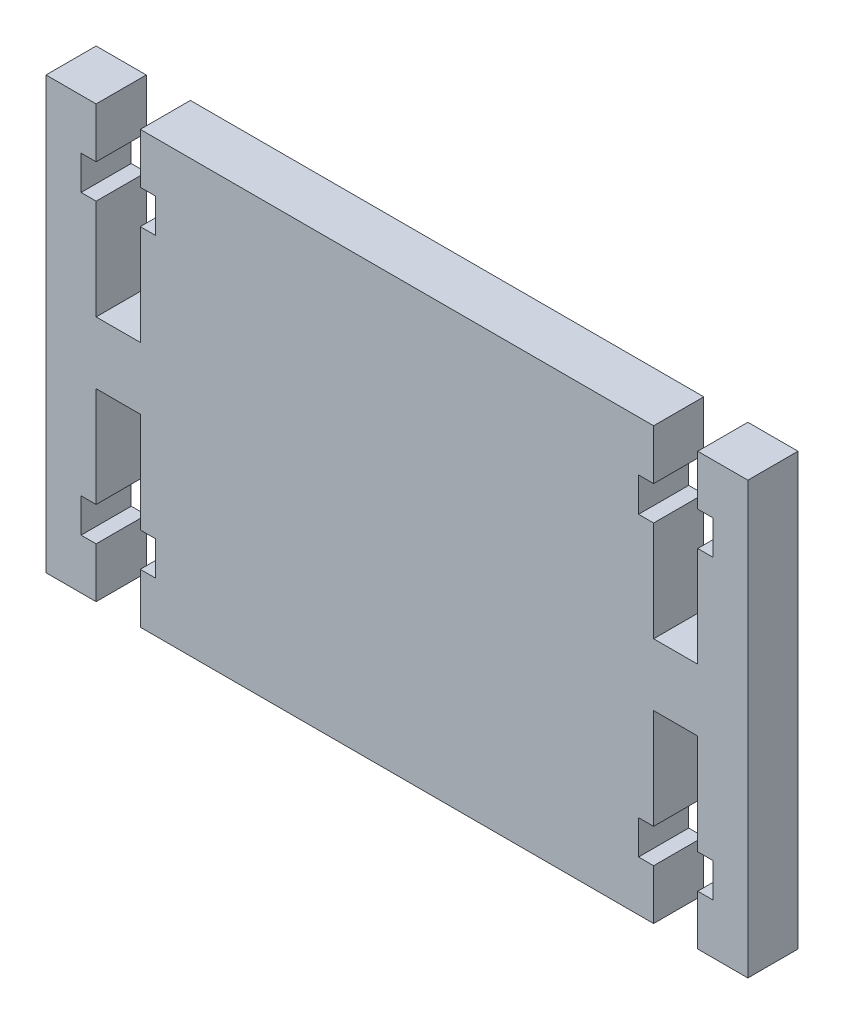
from build123d import *

# Parameters (mm, degrees)
SKETCH1_W           = 70
SKETCH1_H           = 43
BOSS_EXTRUDE1_DEPTH = 5
CUT_EXTRUDE1_DEPTH  = 5


with BuildPart() as part:
    # Sketch1 → Boss-Extrude1 (new body)
    with BuildSketch(Plane.XY):
        Rectangle(SKETCH1_W, SKETCH1_H)
    extrude(amount=BOSS_EXTRUDE1_DEPTH)

    # Sketch3 → Cut-Extrude1 (cut)
    with BuildSketch(Plane.XY.offset(5)):
        Polygon((-25.6, 13.1), (-25.6, 3.1), (-30, 3.1), (-30, 13.1), (-31.5, 13.1), (-31.5, 16.5), (-30, 16.5), (-30, 21.5), (-25.6, 21.5), (-25.6, 16.5), (-24.1, 16.5), (-24.1, 13.1), align=None)
        Polygon((30, 3.1), (30, 13.1), (31.5, 13.1), (31.5, 16.5), (30, 16.5), (30, 21.5), (25.6, 21.5), (25.6, 16.5), (24.1, 16.5), (24.1, 13.1), (25.6, 13.1), (25.6, 3.1), align=None)
        Polygon((25.6, -13.1), (25.6, -3.1), (30, -3.1), (30, -13.1), (31.5, -13.1), (31.5, -16.5), (30, -16.5), (30, -21.5), (25.6, -21.5), (25.6, -16.5), (24.1, -16.5), (24.1, -13.1), align=None)
        Polygon((-30, -3.1), (-30, -13.1), (-31.5, -13.1), (-31.5, -16.5), (-30, -16.5), (-30, -21.5), (-25.6, -21.5), (-25.6, -16.5), (-24.1, -16.5), (-24.1, -13.1), (-25.6, -13.1), (-25.6, -3.1), align=None)
    extrude(amount=-CUT_EXTRUDE1_DEPTH, mode=Mode.SUBTRACT)


solid = part.part
